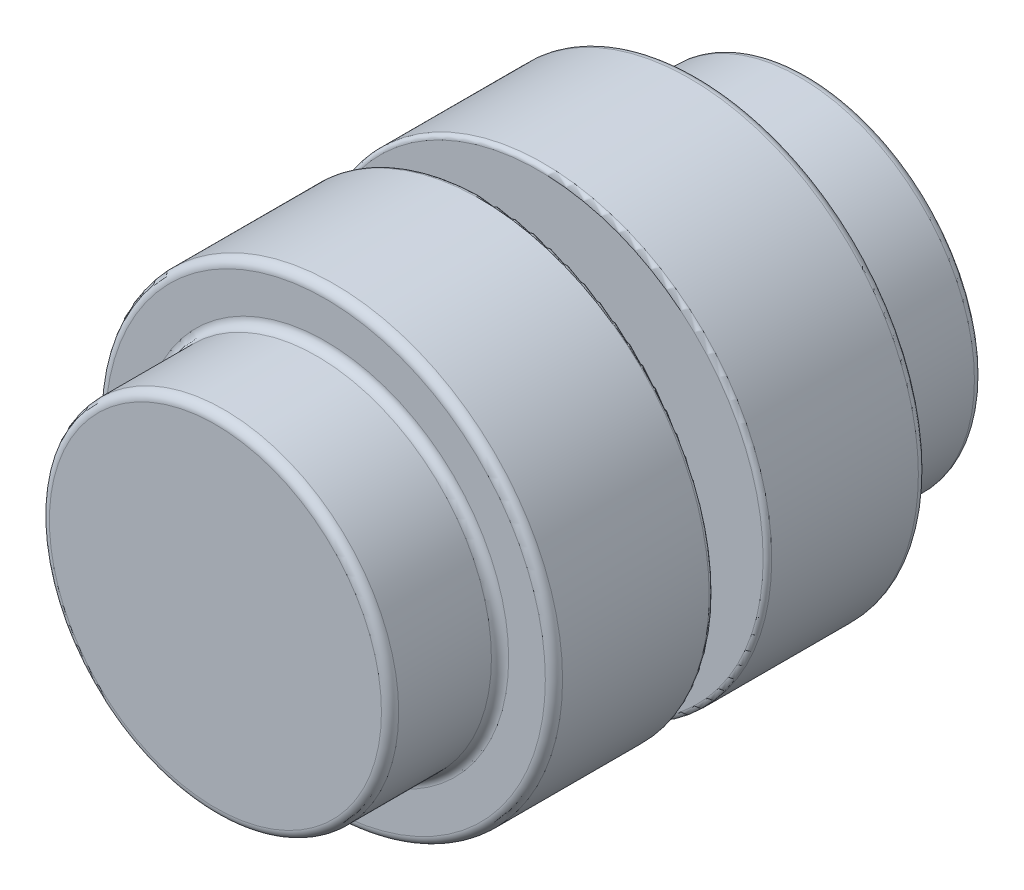
from build123d import *


with BuildPart() as part:
    # Sketch1 → Revolve1 (revolve)
    with BuildSketch(Plane(origin=(0, 0, 0), x_dir=(0, 0, -1), z_dir=(1, 0, 0)), mode=Mode.PRIVATE) as revolve1_sk:
        with BuildLine():
            Line((-17.4625, 0), (-17.4625, 9.779))
            ThreePointArc((-17.4625, 9.779), (-17.313710245, 10.138210245), (-16.9545, 10.287))
            Line((-16.9545, 10.287), (-11.4935, 10.287))
            ThreePointArc((-11.4935, 10.287), (-11.134289755, 10.435789755), (-10.9855, 10.795))
            Line((-10.9855, 10.795), (-10.9855, 12.954))
            ThreePointArc((-10.9855, 12.954), (-10.836710245, 13.313210245), (-10.4775, 13.462))
            Line((-10.4775, 13.462), (-1.8415, 13.462))
            ThreePointArc((-1.8415, 13.462), (-1.661894878, 13.387605122), (-1.5875, 13.208))
            Line((-1.5875, 13.208), (-1.5875, 0))
            Line((-1.5875, 0), (-17.4625, 0))
        make_face()
    revolve(revolve1_sk.sketch.rotate(Axis((0, 0, 121.497728219), (0, 0, -1)), 90), axis=Axis((0, 0, 121.497728219), (0, 0, -1)))


with BuildPart() as body_2:
    # Mirror1: mirrored copy
    add(part.part.mirror(Plane.XY))


solid = Compound([part.part, body_2.part])
